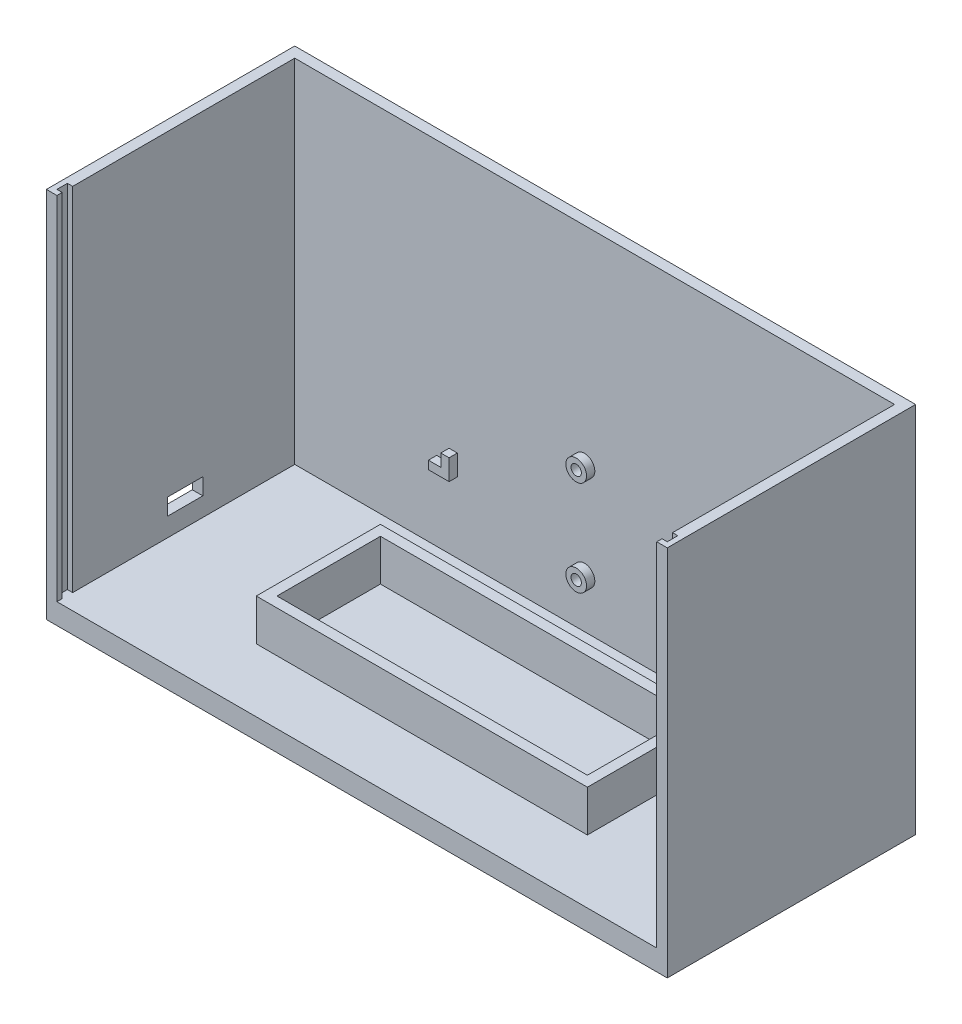
from build123d import *

# Parameters (mm, degrees)
SKETCH1_W           = 150
SKETCH1_H           = 60
BOSS_EXTRUDE1_DEPTH = 90
SKETCH2_W           = 144.92
SKETCH2_H           = 60
CUT_EXTRUDE1_DEPTH  = 85
SKETCH6_R           = 2.499995
SKETCH6_R_2         = 1.25
BOSS_EXTRUDE2_DEPTH = 2
BOSS_EXTRUDE3_DEPTH = 2
SKETCH8_W           = 8.5
SKETCH8_H           = 4
CUT_EXTRUDE4_DEPTH  = 2.54
SKETCH12_W          = 80
SKETCH12_H          = 30
BOSS_EXTRUDE5_DEPTH = 10
SKETCH13_W          = 75
SKETCH13_H          = 25
CUT_EXTRUDE6_DEPTH  = 10
SKETCH16_W          = 1.27
SKETCH16_H          = 2.54
CUT_EXTRUDE7_DEPTH  = 85


with BuildPart() as part:
    # Sketch1 → Boss-Extrude1 (new body)
    with BuildSketch(Plane(origin=(0, 0, 0), x_dir=(1, 0, 0), z_dir=(0, 1, 0))):
        Rectangle(SKETCH1_W, SKETCH1_H)
    extrude(amount=BOSS_EXTRUDE1_DEPTH)

    # Sketch2 → Cut-Extrude1 (cut)
    with BuildSketch(Plane(origin=(0, 90, 0), x_dir=(1, 0, 0), z_dir=(0, 1, 0))):
        with Locations((0, -2.54)):
            Rectangle(SKETCH2_W, SKETCH2_H)
    extrude(amount=-CUT_EXTRUDE1_DEPTH, mode=Mode.SUBTRACT)

    # Sketch6 → Boss-Extrude2 (add)
    # profile 1 of 4: a face of its own
    with BuildSketch(Plane.XY.offset(-27.46)):
        with Locations(Location((-2.46, 39.829239544, 0), (0, 0, 180))):
            Circle(SKETCH6_R)
        with Locations((-2.46, 39.829239544)):
            Circle(SKETCH6_R_2, mode=Mode.SUBTRACT)
    # profile 2 of 4: a face of its own
    with BuildSketch(Plane.XY.offset(-27.46)):
        with Locations(Location((55.54, 39.829239544, 0), (0, 0, 180))):
            Circle(SKETCH6_R)
        with Locations((55.54, 39.829239544)):
            Circle(SKETCH6_R_2, mode=Mode.SUBTRACT)
    # profile 3 of 4: a face of its own
    with BuildSketch(Plane.XY.offset(-27.46)):
        with Locations(Location((55.54, 16.829239544, 0), (0, 0, 180))):
            Circle(SKETCH6_R)
        with Locations((55.54, 16.829239544)):
            Circle(SKETCH6_R_2, mode=Mode.SUBTRACT)
    # profile 4 of 4: a face of its own
    with BuildSketch(Plane.XY.offset(-27.46)):
        with Locations(Location((-2.46, 16.829239544, 0), (0, 0, 180))):
            Circle(SKETCH6_R)
        with Locations((-2.46, 16.829239544)):
            Circle(SKETCH6_R_2, mode=Mode.SUBTRACT)
    extrude(amount=BOSS_EXTRUDE2_DEPTH)

    # Sketch7 → Boss-Extrude3 (add)
    with BuildSketch(Plane.XY.offset(-27.46)):
        Polygon((-38.17, 24.030063331), (-38.17, 22.030063331), (-33.17, 22.030063331), (-33.17, 27.030063331), (-35.17, 27.030063331), (-35.17, 24.030063331), align=None)
    extrude(amount=BOSS_EXTRUDE3_DEPTH)

    # Sketch8 → Cut-Extrude4 (cut)
    with BuildSketch(Plane.ZY.offset(75)):
        with Locations((-1, 11.52476666)):
            Rectangle(SKETCH8_W, SKETCH8_H)
    extrude(amount=-CUT_EXTRUDE4_DEPTH, mode=Mode.SUBTRACT)

    # Sketch12 → Boss-Extrude5 (add)
    with BuildSketch(Plane(origin=(0, 5, 0), x_dir=(1, 0, 0), z_dir=(0, 1, 0))):
        with Locations((0.430037325, 0.273645115)):
            Rectangle(SKETCH12_W, SKETCH12_H)
    extrude(amount=BOSS_EXTRUDE5_DEPTH)

    # Sketch13 → Cut-Extrude6 (cut)
    with BuildSketch(Plane(origin=(0, 15, 0), x_dir=(1, 0, 0), z_dir=(0, 1, 0))):
        with Locations((0.430037325, 0.273645115)):
            Rectangle(SKETCH13_W, SKETCH13_H)
    extrude(amount=-CUT_EXTRUDE6_DEPTH, mode=Mode.SUBTRACT)

    # Sketch16 → Cut-Extrude7 (cut)
    with BuildSketch(Plane(origin=(0, 90, 0), x_dir=(1, 0, 0), z_dir=(0, 1, 0))):
        with Locations((-73.095, -27.46)):
            Rectangle(SKETCH16_W, SKETCH16_H)
        with Locations((73.095, -27.46)):
            Rectangle(SKETCH16_W, SKETCH16_H)
    extrude(amount=-CUT_EXTRUDE7_DEPTH, mode=Mode.SUBTRACT)


solid = part.part
